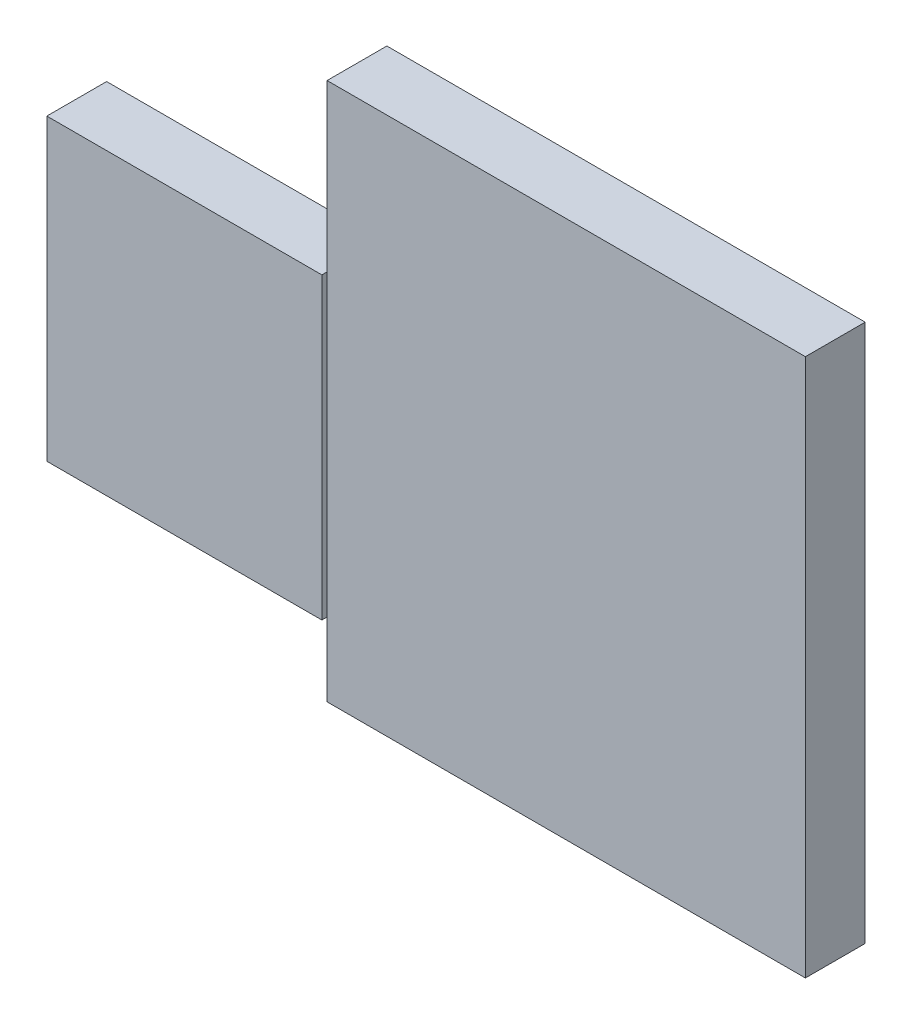
from build123d import *

# Parameters (mm, degrees)
SKETCH_1_W        = 40
SKETCH_1_H        = 45
EXTRUDE_1_DEPTH   = 5
SKETCH_1_W_2      = 23
SKETCH_1_H_2      = 25
EXTRUDE_1_2_DEPTH = 5


with BuildPart() as part:
    # 草图1 → 凸台-拉伸1 (new body)
    with BuildSketch(Plane.XY):
        with Locations((20, -22.5)):
            Rectangle(SKETCH_1_W, SKETCH_1_H)
    extrude(amount=EXTRUDE_1_DEPTH)


with BuildPart() as body_2:
    # 草图1 → Extrude 1 2 (new body)
    with BuildSketch(Plane.XY):
        with Locations((-11.937690517, -26.793552103)):
            Rectangle(SKETCH_1_W_2, SKETCH_1_H_2)
    extrude(amount=EXTRUDE_1_2_DEPTH)


solid = Compound([part.part, body_2.part])
